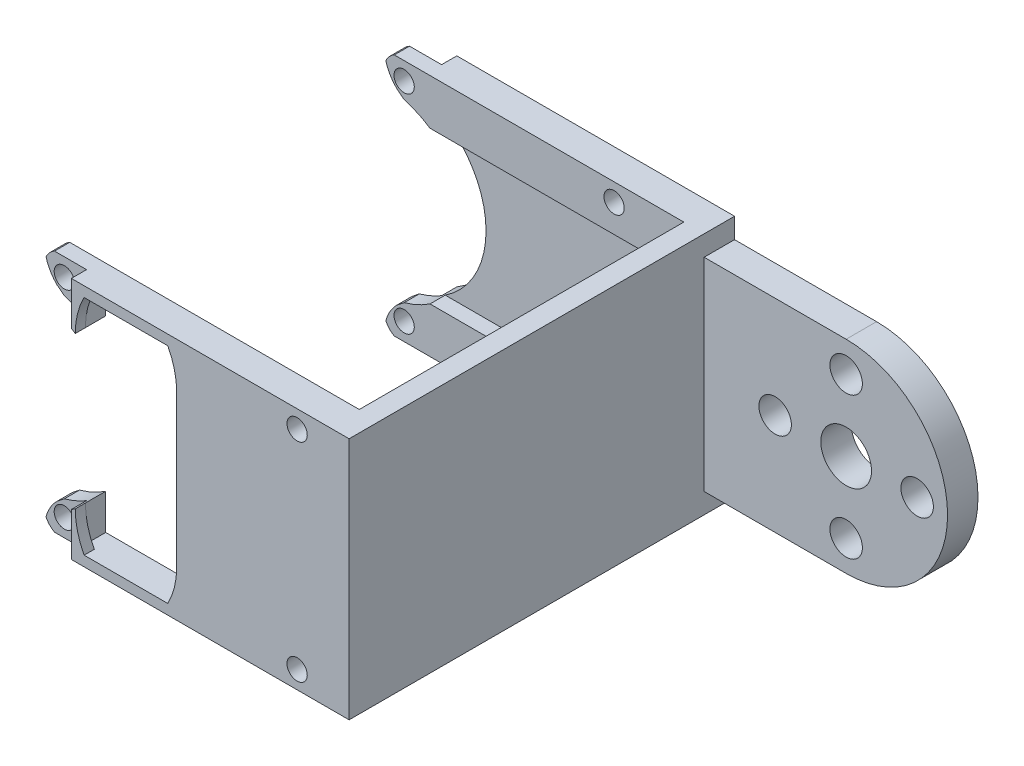
from build123d import *

# Parameters (mm, degrees)
SKETCH_1_W           = 58
SKETCH_1_H           = 24
EXTRUDE_1_DEPTH      = 3
SKETCH_2_W           = 2
SKETCH_2_H           = 24
EXTRUDE_2_DEPTH      = 32
SKETCH_3_W           = 3
SKETCH_3_H           = 24
EXTRUDE_3_DEPTH      = 32
SKETCH_4_R           = 9
CUT_EXTRUDE_1_DEPTH  = 74.375745311
CUT_EXTRUDE_2_REACH  = 75.376
SKETCH_5_R           = 1
CUT_EXTRUDE_3_REACH  = 75.376
SKETCH_6_W           = 10
SKETCH_6_H           = 22
SKETCH_7_W           = 2
SKETCH_7_H           = 22
CUT_EXTRUDE_4_DEPTH  = 6
CUT_EXTRUDE_5_REACH  = 75.376
SKETCH_8_R           = 1
EXTRUDE_4_DEPTH      = 1
CUT_EXTRUDE_6_DEPTH  = 74.375745311
CUT_EXTRUDE_7_DEPTH  = 74.375745311
CUT_EXTRUDE_8_DEPTH  = 74.375745311
SKETCH_15_W          = 10.429412993
SKETCH_15_H          = 1.5
CUT_EXTRUDE_9_DEPTH  = 74.375745311
SKETCH_16_W          = 1.5
SKETCH_16_H          = 15
CUT_EXTRUDE_10_DEPTH = 27.576338772
CUT_EXTRUDE_11_REACH = 73.868
SKETCH_17_R          = 1.6
SKETCH_17_R_2        = 2.5
CUT_EXTRUDE_12_REACH = 75.376


with BuildPart() as part:
    # 草图1 → 凸台-拉伸1 (new body)
    with BuildSketch(Plane.XY):
        with Locations((29, 12)):
            Rectangle(SKETCH_1_W, SKETCH_1_H)
    extrude(amount=EXTRUDE_1_DEPTH)

    # 草图2 → 凸台-拉伸2 (add)
    with BuildSketch(Plane.XY.offset(3)):
        with Locations((31, 12)):
            Rectangle(SKETCH_2_W, SKETCH_2_H)
    extrude(amount=EXTRUDE_2_DEPTH)

    # 草图3 → 凸台-拉伸3 (add)
    with BuildSketch(Plane(origin=(32, 0, 0), x_dir=(0, 0, -1), z_dir=(1, 0, 0))):
        with Locations((-36.5, 12)):
            Rectangle(SKETCH_3_W, SKETCH_3_H)
    extrude(amount=-EXTRUDE_3_DEPTH)

    # 草图4 → 切除-拉伸1 (cut, through all)
    with BuildSketch(Plane(origin=(0, 0, 0), x_dir=(-1, 0, 0), z_dir=(0, 0, -1))):
        with Locations((0, 12)):
            Circle(SKETCH_4_R)
    extrude(amount=-CUT_EXTRUDE_1_DEPTH, mode=Mode.SUBTRACT)

    # 草图5 → 切除-拉伸2 (cut, up to next)
    with BuildSketch(Plane(origin=(0, 0, 0), x_dir=(-1, 0, 0), z_dir=(0, 0, -1)), mode=Mode.PRIVATE) as cut_extrude_2_sk1:
        with Locations((-2.423661228, 22.25)):
            Circle(SKETCH_5_R)
    cut_extrude_2_tool1 = extrude(cut_extrude_2_sk1.sketch, amount=-CUT_EXTRUDE_2_REACH, mode=Mode.PRIVATE) & part.part
    # 草图5 → 切除-拉伸2 (cut, up to next)
    with BuildSketch(Plane(origin=(0, 0, 0), x_dir=(-1, 0, 0), z_dir=(0, 0, -1)), mode=Mode.PRIVATE) as cut_extrude_2_sk2:
        with Locations((-2.423661228, 1.75)):
            Circle(SKETCH_5_R)
    cut_extrude_2_tool2 = extrude(cut_extrude_2_sk2.sketch, amount=-CUT_EXTRUDE_2_REACH, mode=Mode.PRIVATE) & part.part
    # 草图5 → 切除-拉伸2 (cut, up to next)
    with BuildSketch(Plane(origin=(0, 0, 0), x_dir=(-1, 0, 0), z_dir=(0, 0, -1)), mode=Mode.PRIVATE) as cut_extrude_2_sk3:
        with Locations((-23.123661228, 1.75)):
            Circle(SKETCH_5_R)
    cut_extrude_2_tool3 = extrude(cut_extrude_2_sk3.sketch, amount=-CUT_EXTRUDE_2_REACH, mode=Mode.PRIVATE) & part.part
    # 草图5 → 切除-拉伸2 (cut, up to next)
    with BuildSketch(Plane(origin=(0, 0, 0), x_dir=(-1, 0, 0), z_dir=(0, 0, -1)), mode=Mode.PRIVATE) as cut_extrude_2_sk4:
        with Locations((-23.123661228, 22.25)):
            Circle(SKETCH_5_R)
    cut_extrude_2_tool4 = extrude(cut_extrude_2_sk4.sketch, amount=-CUT_EXTRUDE_2_REACH, mode=Mode.PRIVATE) & part.part
    add(cut_extrude_2_tool1.solids().sort_by_distance((2.423661, 22.25, 0))[0], mode=Mode.SUBTRACT)
    add(cut_extrude_2_tool2.solids().sort_by_distance((2.423661, 1.75, 0))[0], mode=Mode.SUBTRACT)
    add(cut_extrude_2_tool3.solids().sort_by_distance((23.123661, 1.75, 0))[0], mode=Mode.SUBTRACT)
    add(cut_extrude_2_tool4.solids().sort_by_distance((23.123661, 22.25, 0))[0], mode=Mode.SUBTRACT)

    # 草图6 → 切除-拉伸3 (cut, up to next)
    with BuildSketch(Plane.XY.offset(38), mode=Mode.PRIVATE) as cut_extrude_3_sk1:
        with Locations((10, 12)):
            Rectangle(SKETCH_6_W, SKETCH_6_H)
    cut_extrude_3_tool1 = extrude(cut_extrude_3_sk1.sketch, amount=-CUT_EXTRUDE_3_REACH, mode=Mode.PRIVATE) & part.part
    add(cut_extrude_3_tool1.solids().sort_by_distance((10, 12, 38))[0], mode=Mode.SUBTRACT)

    # 草图7 → 切除-拉伸4 (cut)
    with BuildSketch(Plane.ZY.offset(-15)):
        with Locations((36, 12)):
            Rectangle(SKETCH_7_W, SKETCH_7_H)
    extrude(amount=-CUT_EXTRUDE_4_DEPTH, mode=Mode.SUBTRACT)

    # 草图8 → 切除-拉伸5 (cut, up to next)
    with BuildSketch(Plane.XY.offset(38), mode=Mode.PRIVATE) as cut_extrude_5_sk1:
        with Locations(Location((2.423661228, 22.25, 0), (0, 0, 180))):
            Circle(SKETCH_8_R)
    cut_extrude_5_tool1 = extrude(cut_extrude_5_sk1.sketch, amount=-CUT_EXTRUDE_5_REACH, mode=Mode.PRIVATE) & part.part
    # 草图8 → 切除-拉伸5 (cut, up to next)
    with BuildSketch(Plane.XY.offset(38), mode=Mode.PRIVATE) as cut_extrude_5_sk2:
        with Locations(Location((2.423661228, 1.75, 0), (0, 0, 180))):
            Circle(SKETCH_8_R)
    cut_extrude_5_tool2 = extrude(cut_extrude_5_sk2.sketch, amount=-CUT_EXTRUDE_5_REACH, mode=Mode.PRIVATE) & part.part
    # 草图8 → 切除-拉伸5 (cut, up to next)
    with BuildSketch(Plane.XY.offset(38), mode=Mode.PRIVATE) as cut_extrude_5_sk3:
        with Locations((26.873661228, 22.25)):
            Circle(SKETCH_8_R)
    cut_extrude_5_tool3 = extrude(cut_extrude_5_sk3.sketch, amount=-CUT_EXTRUDE_5_REACH, mode=Mode.PRIVATE) & part.part
    # 草图8 → 切除-拉伸5 (cut, up to next)
    with BuildSketch(Plane.XY.offset(38), mode=Mode.PRIVATE) as cut_extrude_5_sk4:
        with Locations((26.873661228, 1.75)):
            Circle(SKETCH_8_R)
    cut_extrude_5_tool4 = extrude(cut_extrude_5_sk4.sketch, amount=-CUT_EXTRUDE_5_REACH, mode=Mode.PRIVATE) & part.part
    add(cut_extrude_5_tool1.solids().sort_by_distance((2.423661, 22.25, 38))[0], mode=Mode.SUBTRACT)
    add(cut_extrude_5_tool2.solids().sort_by_distance((2.423661, 1.75, 38))[0], mode=Mode.SUBTRACT)
    add(cut_extrude_5_tool3.solids().sort_by_distance((26.873661, 22.25, 38))[0], mode=Mode.SUBTRACT)
    add(cut_extrude_5_tool4.solids().sort_by_distance((26.873661, 1.75, 38))[0], mode=Mode.SUBTRACT)

    # 草图9 → 凸台-拉伸4 (add)
    with BuildSketch(Plane.XY.offset(38)):
        with BuildLine():
            Line((5, 1), (5.875581156, 1))
            ThreePointArc((5.875581156, 1), (5.222186409, 2.704661679), (5, 4.516685226))
            Line((5, 4.516685226), (5, 1))
        make_face()
        with BuildLine():
            Line((15, 23), (14.124418844, 23))
            ThreePointArc((14.124418844, 23), (14.777813591, 21.295338321), (15, 19.483314774))
            Line((15, 19.483314774), (15, 23))
        make_face()
        with BuildLine():
            Line((15, 4.516685226), (15, 1))
            Line((15, 1), (14.124418844, 1))
            ThreePointArc((14.124418844, 1), (14.777813591, 2.704661679), (15, 4.516685226))
        make_face()
        with BuildLine():
            Line((5, 19.483314774), (5, 23))
            Line((5, 23), (5.875581156, 23))
            ThreePointArc((5.875581156, 23), (5.222186409, 21.295338321), (5, 19.483314774))
        make_face()
    extrude(amount=-EXTRUDE_4_DEPTH)

    # 草图11 → 切除-拉伸6 (cut, through all)
    with BuildSketch(Plane(origin=(0, 0, 0), x_dir=(-1, 0, 0), z_dir=(0, 0, -1))):
        with BuildLine():
            Line((0, 21), (0, 24))
            Line((0, 24), (-1.455415392, 24))
            ThreePointArc((-1.455415392, 24), (-0.456169147, 22.609130768), (-0.899591526, 20.954927978))
            ThreePointArc((-0.899591526, 20.954927978), (-0.450359967, 20.988724932), (0, 21))
        make_face()
        with BuildLine():
            Line((-1.455415392, 0), (0, 0))
            Line((0, 0), (0, 3))
            ThreePointArc((0, 3), (-0.450359967, 3.011275068), (-0.899591526, 3.045072022))
            ThreePointArc((-0.899591526, 3.045072022), (-0.456169147, 1.390869232), (-1.455415392, 0))
        make_face()
    extrude(amount=-CUT_EXTRUDE_6_DEPTH, mode=Mode.SUBTRACT)

    # 草图12 → 切除-拉伸7 (cut, through all)
    with BuildSketch(Plane(origin=(0, 0, 0), x_dir=(-1, 0, 0), z_dir=(0, 0, -1))):
        with BuildLine():
            ThreePointArc((-0.899591526, 3.045072022), (-1.667828935, 3.155886328), (-2.423661228, 3.332482117))
            Line((-2.423661228, 3.332482117), (-0.423661228, 1.75))
            ThreePointArc((-0.423661228, 1.75), (-0.546410658, 2.439877016), (-0.899591526, 3.045072022))
        make_face()
        with BuildLine():
            ThreePointArc((-0.899591526, 20.954927978), (-0.546410658, 21.560122984), (-0.423661228, 22.25))
            Line((-0.423661228, 22.25), (-2.423661228, 20.667517883))
            ThreePointArc((-2.423661228, 20.667517883), (-1.667828935, 20.844113672), (-0.899591526, 20.954927978))
        make_face()
    extrude(amount=-CUT_EXTRUDE_7_DEPTH, mode=Mode.SUBTRACT)

    # 草图13 → 切除-拉伸8 (cut, through all)
    with BuildSketch(Plane(origin=(0, 0, 0), x_dir=(-1, 0, 0), z_dir=(0, 0, -1))):
        with BuildLine():
            ThreePointArc((-0.616666185, 23.107186627), (-1.037059303, 22.099034069), (-1.705884996, 21.235451909))
            Line((-1.705884996, 21.235451909), (-0.423661228, 22.25))
            ThreePointArc((-0.423661228, 22.25), (-0.472508993, 22.689323294), (-0.616666185, 23.107186627))
        make_face()
        with BuildLine():
            ThreePointArc((-0.616666185, 0.892813373), (-0.472508993, 1.310676706), (-0.423661228, 1.75))
            Line((-0.423661228, 1.75), (-1.705884996, 2.764548091))
            ThreePointArc((-1.705884996, 2.764548091), (-1.037059303, 1.900965931), (-0.616666185, 0.892813373))
        make_face()
    extrude(amount=-CUT_EXTRUDE_8_DEPTH, mode=Mode.SUBTRACT)

    # 草图15 → 切除-拉伸9 (cut, through all)
    with BuildSketch(Plane(origin=(0, 24, 0), x_dir=(1, 0, 0), z_dir=(0, 1, 0))):
        with Locations((-0.598040311, -37.25)):
            Rectangle(SKETCH_15_W, SKETCH_15_H)
        with Locations((-0.598040311, -0.75)):
            Rectangle(SKETCH_15_W, SKETCH_15_H)
    extrude(amount=-CUT_EXTRUDE_9_DEPTH, mode=Mode.SUBTRACT)

    # 草图16 → 切除-拉伸10 (cut)
    with BuildSketch(Plane.ZY.offset(-2.423661228)):
        with Locations((2.25, 12)):
            Rectangle(SKETCH_16_W, SKETCH_16_H)
    extrude(amount=-CUT_EXTRUDE_10_DEPTH, mode=Mode.SUBTRACT)

    # 草图17 → 切除-拉伸11 (cut, up to next)
    with BuildSketch(Plane.XY.offset(3), mode=Mode.PRIVATE) as cut_extrude_11_sk1:
        with Locations((53, 12)):
            Circle(SKETCH_17_R)
    cut_extrude_11_tool1 = extrude(cut_extrude_11_sk1.sketch, amount=-CUT_EXTRUDE_11_REACH, mode=Mode.PRIVATE) & part.part
    # 草图17 → 切除-拉伸11 (cut, up to next)
    with BuildSketch(Plane.XY.offset(3), mode=Mode.PRIVATE) as cut_extrude_11_sk2:
        with Locations((46, 12)):
            Circle(SKETCH_17_R_2)
    cut_extrude_11_tool2 = extrude(cut_extrude_11_sk2.sketch, amount=-CUT_EXTRUDE_11_REACH, mode=Mode.PRIVATE) & part.part
    # 草图17 → 切除-拉伸11 (cut, up to next)
    with BuildSketch(Plane.XY.offset(3), mode=Mode.PRIVATE) as cut_extrude_11_sk3:
        with Locations((46, 19)):
            Circle(SKETCH_17_R)
    cut_extrude_11_tool3 = extrude(cut_extrude_11_sk3.sketch, amount=-CUT_EXTRUDE_11_REACH, mode=Mode.PRIVATE) & part.part
    # 草图17 → 切除-拉伸11 (cut, up to next)
    with BuildSketch(Plane.XY.offset(3), mode=Mode.PRIVATE) as cut_extrude_11_sk4:
        with Locations((46, 5)):
            Circle(SKETCH_17_R)
    cut_extrude_11_tool4 = extrude(cut_extrude_11_sk4.sketch, amount=-CUT_EXTRUDE_11_REACH, mode=Mode.PRIVATE) & part.part
    # 草图17 → 切除-拉伸11 (cut, up to next)
    with BuildSketch(Plane.XY.offset(3), mode=Mode.PRIVATE) as cut_extrude_11_sk5:
        with Locations((39, 12)):
            Circle(SKETCH_17_R)
    cut_extrude_11_tool5 = extrude(cut_extrude_11_sk5.sketch, amount=-CUT_EXTRUDE_11_REACH, mode=Mode.PRIVATE) & part.part
    add(cut_extrude_11_tool1.solids().sort_by_distance((53, 12, 3))[0], mode=Mode.SUBTRACT)
    add(cut_extrude_11_tool2.solids().sort_by_distance((46, 12, 3))[0], mode=Mode.SUBTRACT)
    add(cut_extrude_11_tool3.solids().sort_by_distance((46, 19, 3))[0], mode=Mode.SUBTRACT)
    add(cut_extrude_11_tool4.solids().sort_by_distance((46, 5, 3))[0], mode=Mode.SUBTRACT)
    add(cut_extrude_11_tool5.solids().sort_by_distance((39, 12, 3))[0], mode=Mode.SUBTRACT)

    # 草图18 → 切除-拉伸12 (cut, up to next)
    with BuildSketch(Plane(origin=(0, 0, 0), x_dir=(-1, 0, 0), z_dir=(0, 0, -1)), mode=Mode.PRIVATE) as cut_extrude_12_sk1:
        with BuildLine():
            Line((-32, 2), (-46, 2))
            ThreePointArc((-46, 2), (-53.071067812, 4.928932188), (-56, 12))
            Line((-56, 12), (-58, 12))
            Line((-58, 12), (-58, 0))
            Line((-58, 0), (-32, 0))
            Line((-32, 0), (-32, 2))
        make_face()
    cut_extrude_12_tool1 = extrude(cut_extrude_12_sk1.sketch, amount=-CUT_EXTRUDE_12_REACH, mode=Mode.PRIVATE) & part.part
    # 草图18 → 切除-拉伸12 (cut, up to next)
    with BuildSketch(Plane(origin=(0, 0, 0), x_dir=(-1, 0, 0), z_dir=(0, 0, -1)), mode=Mode.PRIVATE) as cut_extrude_12_sk2:
        with BuildLine():
            Line((-58, 12), (-56, 12))
            ThreePointArc((-56, 12), (-53.071067812, 19.071067812), (-46, 22))
            Line((-46, 22), (-32, 22))
            Line((-32, 22), (-32, 24))
            Line((-32, 24), (-58, 24))
            Line((-58, 24), (-58, 12))
        make_face()
    cut_extrude_12_tool2 = extrude(cut_extrude_12_sk2.sketch, amount=-CUT_EXTRUDE_12_REACH, mode=Mode.PRIVATE) & part.part
    add(cut_extrude_12_tool1.solids().sort_by_distance((39, 1.713644, 0))[0], mode=Mode.SUBTRACT)
    add(cut_extrude_12_tool2.solids().sort_by_distance((57.713644, 18, 0))[0], mode=Mode.SUBTRACT)


solid = part.part
